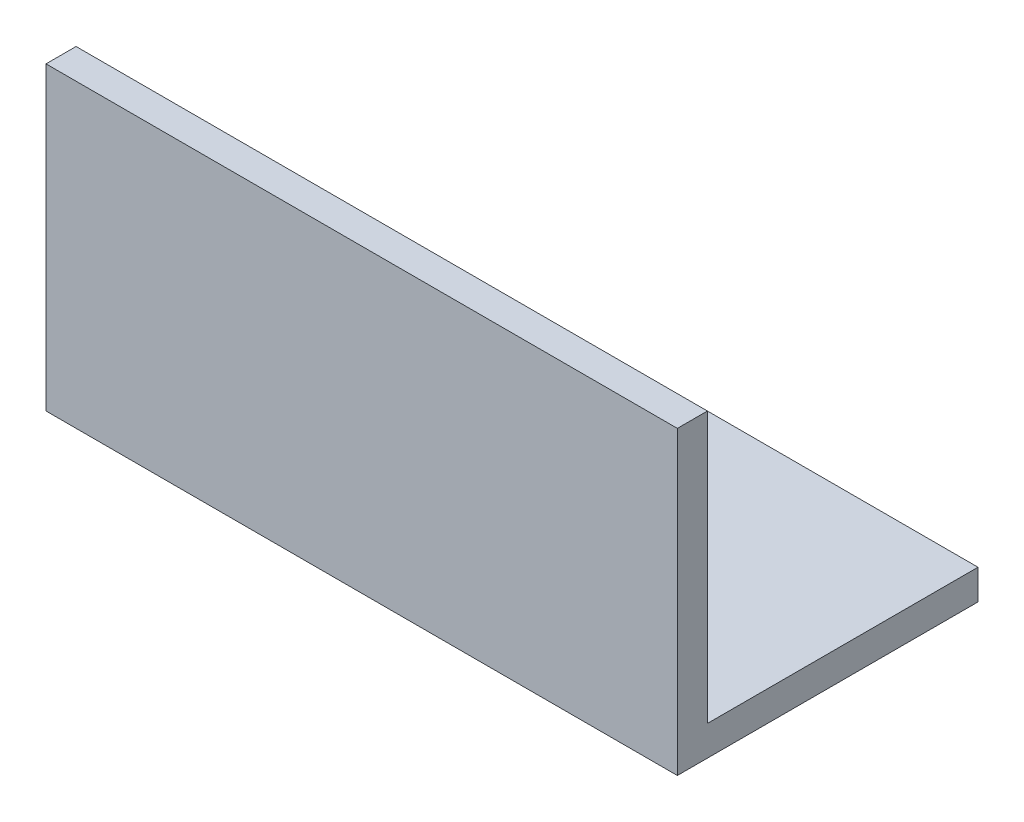
from build123d import *

# Parameters (mm, degrees)
BOSS_EXTRUDE1_DEPTH = 42


with BuildPart() as part:
    # Sketch1 → Boss-Extrude1 (new body)
    with BuildSketch(Plane(origin=(0, 0, 0), x_dir=(0, 0, -1), z_dir=(1, 0, 0))):
        Polygon((0, 20), (0, 0), (20, 0), (20, 2), (2, 2), (2, 20), align=None)
    extrude(amount=-BOSS_EXTRUDE1_DEPTH)


solid = part.part
